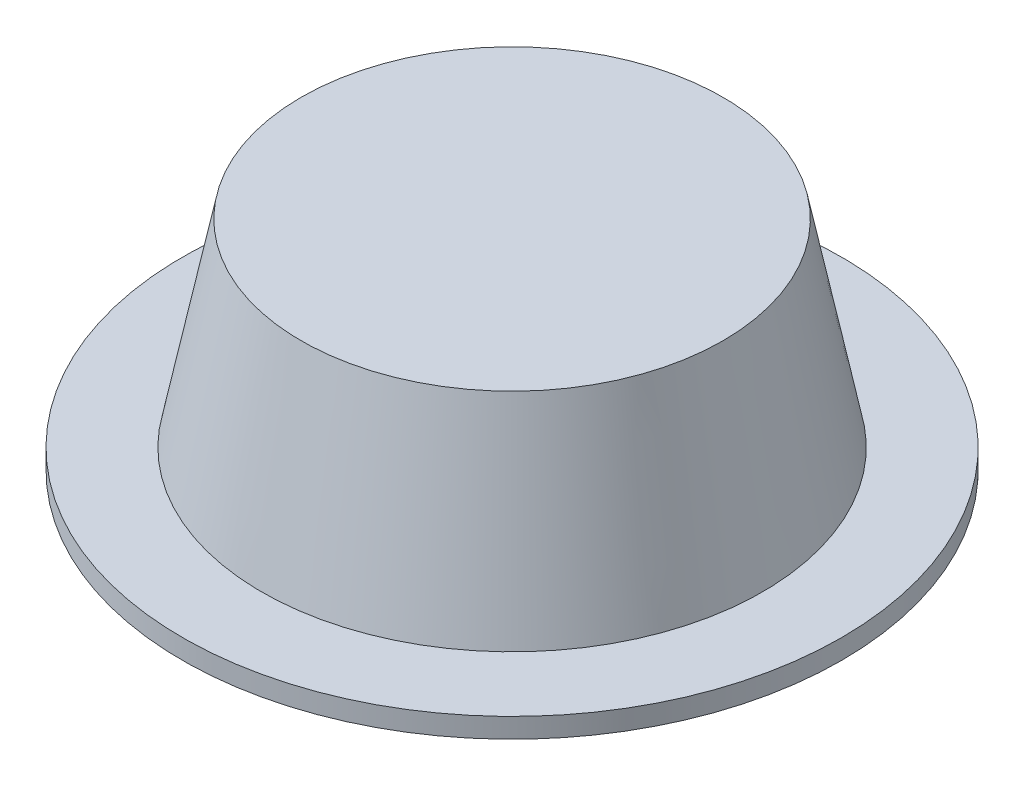
from build123d import *

# Parameters (mm, degrees)
SHELL1_T            = -3
SKETCH2_R           = 25
SKETCH2_R_2         = 15.940588292
BOSS_EXTRUDE1_DEPTH = 1.5
SKETCH5_W           = 4
SKETCH5_H           = 12
BOSS_EXTRUDE3_DEPTH = 11


with BuildPart() as part:
    # Sketch1 → Revolve1 (revolve)
    with BuildSketch(Plane.XY, mode=Mode.PRIVATE) as revolve1_sk:
        Polygon((0, 15), (0, 0), (19, 0), (16, 15), align=None)
    revolve(revolve1_sk.sketch.rotate(Axis((0, 15, 0), (0, -1, 0)), 180), axis=Axis((0, 15, 0), (0, -1, 0)))

    # Shell1
    shell1_openings = [part.faces().sort_by_distance(p)[0] for p in [
        (0, 0, 0),
    ]]
    offset(amount=SHELL1_T, openings=shell1_openings, kind=Kind.INTERSECTION)

    # Sketch5 → Boss-Extrude3 (add)
    with BuildSketch(Plane.XZ.offset(-12)):
        Rectangle(SKETCH5_W, SKETCH5_H)
    extrude(amount=BOSS_EXTRUDE3_DEPTH)


with BuildPart() as body_2:
    # Sketch2 → Boss-Extrude1 (new body)
    with BuildSketch(Plane.XZ):
        Circle(SKETCH2_R)
        Circle(SKETCH2_R_2, mode=Mode.SUBTRACT)
    extrude(amount=BOSS_EXTRUDE1_DEPTH)


solid = Compound([part.part, body_2.part])
